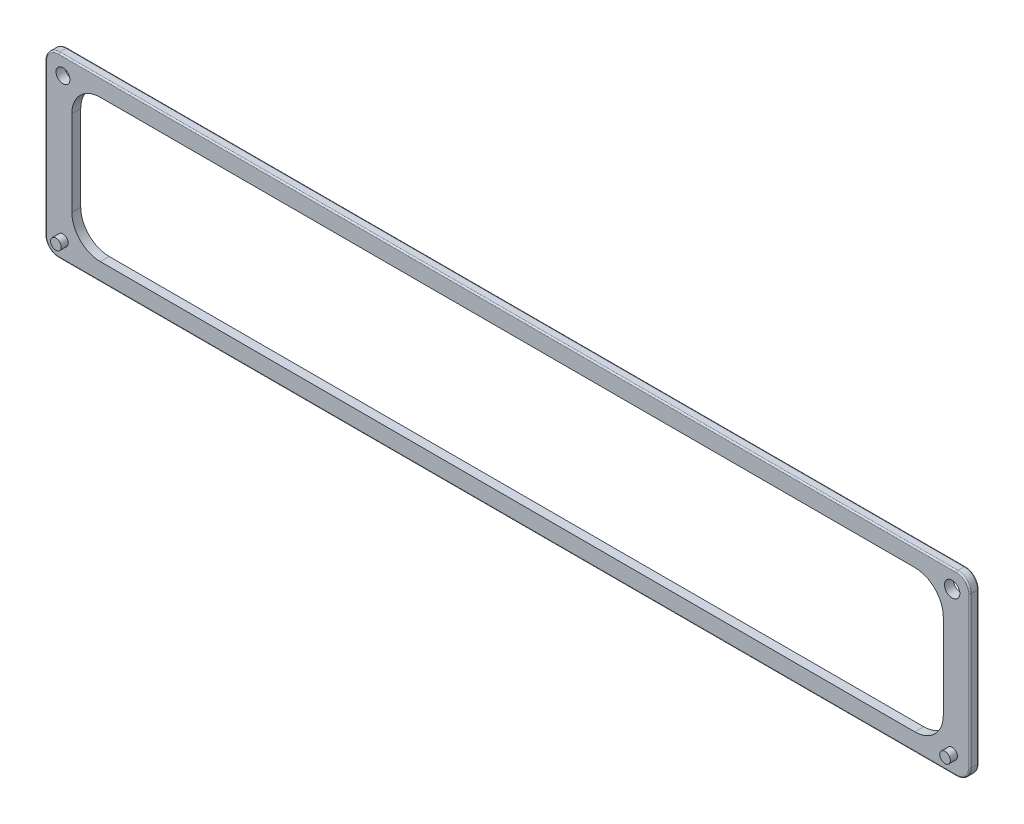
from build123d import *

# Parameters (mm, degrees)
SKETCH1_W               = 82.55
SKETCH1_H               = 15.875
BOSS_EXTRUDE1_DEPTH     = 0.79375
SKETCH4_R               = 0.474599
BOSS_EXTRUDE2_DEPTH     = 0.635
MIRROR2_COPY_1_SKETCH_R = 0.474599
MIRROR2_COPY_1_DEPTH    = 0.635
CUT_EXTRUDE3_DEPTH      = 43.038786499
SKETCH7_R               = 0.6223
SKETCH7_R_2             = 0.6858
CUT_EXTRUDE4_DEPTH      = 43.05556869
FILLET1_R               = 1.1938
FILLET2_R               = 0.127


with BuildPart() as part:
    # Sketch1 → Boss-Extrude1 (new body)
    with BuildSketch(Plane.XY):
        Rectangle(SKETCH1_W, SKETCH1_H)
    extrude(amount=BOSS_EXTRUDE1_DEPTH)

    # Sketch4 → Boss-Extrude2 (add)
    with BuildSketch(Plane.XY.offset(0.79375)):
        with Locations((39.6875, 6.35)):
            Circle(SKETCH4_R)
    boss_extrude2 = extrude(amount=BOSS_EXTRUDE2_DEPTH)

    # Mirror1: Boss-Extrude2 across plane
    add(boss_extrude2.mirror(Plane.ZX))

    # Mirror2: Boss-Extrude2 across plane
    add(boss_extrude2.mirror(Plane(origin=(0, 0, 0), x_dir=(0, 0, 1), z_dir=(1, 0, 0))))

    # Mirror2 copy 1 sketch → Mirror2 copy 1 (add)
    with BuildSketch(Plane(origin=(0, 0, 0.79375), x_dir=(-1, 0, 0), z_dir=(0, 0, 1))):
        with Locations((39.6875, 6.35)):
            Circle(MIRROR2_COPY_1_SKETCH_R)
    extrude(amount=MIRROR2_COPY_1_DEPTH)

    # Sketch6 → Cut-Extrude3 (cut, through all)
    with BuildSketch(Plane.XY.offset(0.79375)):
        with BuildLine():
            Line((-36.35375, 6.35), (36.35375, 6.35))
            ThreePointArc((36.35375, 6.35), (38.149801224, 5.606051224), (38.89375, 3.81))
            Line((38.89375, 3.81), (38.89375, -3.81))
            ThreePointArc((38.89375, -3.81), (38.149801224, -5.606051224), (36.35375, -6.35))
            Line((36.35375, -6.35), (-36.35375, -6.35))
            ThreePointArc((-36.35375, -6.35), (-38.149801224, -5.606051224), (-38.89375, -3.81))
            Line((-38.89375, -3.81), (-38.89375, 3.81))
            ThreePointArc((-38.89375, 3.81), (-38.149801224, 5.606051224), (-36.35375, 6.35))
        make_face()
    extrude(amount=-CUT_EXTRUDE3_DEPTH, mode=Mode.SUBTRACT)

    # Sketch7 → Cut-Extrude4 (cut, through all)
    with BuildSketch(Plane.XY.offset(1.42875)):
        with Locations((-39.6875, 6.35)):
            Circle(SKETCH7_R)
        with Locations((39.6875, 6.35)):
            Circle(SKETCH7_R_2)
    extrude(amount=-CUT_EXTRUDE4_DEPTH, mode=Mode.SUBTRACT)

    # Fillet1
    fillet1_edges = [part.edges().sort_by_distance(p)[0] for p in [
        (41.275, -7.9375, 0.396875),
        (-41.275, -7.9375, 0.396875),
        (-41.275, 7.9375, 0.396875),
        (41.275, 7.9375, 0.396875),
    ]]
    fillet(fillet1_edges, radius=FILLET1_R)

    # Fillet2
    fillet2_edges = [part.edges().sort_by_distance(p)[0] for p in [
        (0, 7.9375, 0),
        (0, 7.9375, 0.79375),
        (41.275, 0, 0),
        (0, -7.9375, 0),
        (-41.275, 0, 0),
        (-40.925344075, 7.587844075, 0),
        (-40.925344075, -7.587844075, 0),
        (40.925344075, -7.587844075, 0),
        (40.925344075, 7.587844075, 0),
        (41.275, 0, 0.79375),
        (-41.275, 0, 0.79375),
        (0, -7.9375, 0.79375),
        (-40.925344075, 7.587844075, 0.79375),
        (-40.925344075, -7.587844075, 0.79375),
        (40.925344075, -7.587844075, 0.79375),
        (40.925344075, 7.587844075, 0.79375),
    ]]
    fillet(fillet2_edges, radius=FILLET2_R)


solid = part.part
